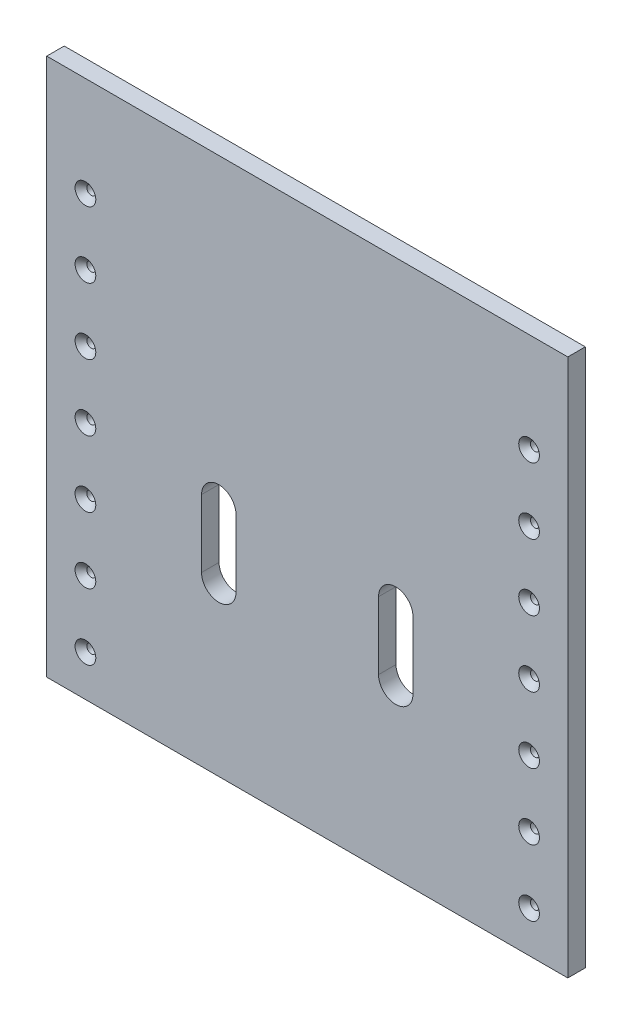
from build123d import *

# Parameters (mm, degrees)
SKETCH1_W                                       = 196.85
SKETCH1_H                                       = 203.2
BOSS_EXTRUDE1_DEPTH                             = 6.604
CUT_EXTRUDE7_DEPTH                              = 313.254468048
SKETCH4_W                                       = 196.85
SKETCH4_H                                       = 0.6096
BOSS_EXTRUDE2_DEPTH                             = 12
SKETCH14_W                                      = 196.85
SKETCH14_H                                      = 11.938
BOSS_EXTRUDE3_DEPTH                             = 6.604
SKETCH13_W                                      = 196.85
SKETCH13_H                                      = 0.6096
CUT_EXTRUDE9_DEPTH                              = 12
CSK_FOR_M3_FLAT_HEAD_MACHINE_SCREW3_D           = 3.4
CSK_FOR_M3_FLAT_HEAD_MACHINE_SCREW3_CSINK_D     = 7.824
CSK_FOR_M3_FLAT_HEAD_MACHINE_SCREW3_CSINK_ANGLE = 90


with BuildPart() as part:
    # Sketch1 → Boss-Extrude1 (new body)
    with BuildSketch(Plane(origin=(0, 0, 0), x_dir=(1, 0, 0), z_dir=(0, 0, -1))):
        with Locations((-104.775, 135.4)):
            Rectangle(SKETCH1_W, SKETCH1_H)
    extrude(amount=BOSS_EXTRUDE1_DEPTH)

    # Sketch2 → Cut-Extrude7 (cut, through all)
    with BuildSketch(Plane(origin=(0, 0, -6.604), x_dir=(1, 0, 0), z_dir=(0, 0, -1))):
        with BuildLine():
            Line((-131.7, 173.5), (-131.7, 148))
            ThreePointArc((-131.7, 148), (-138.2, 141.5), (-144.7, 148))
            Line((-144.7, 148), (-144.7, 173.5))
            ThreePointArc((-144.7, 173.5), (-138.2, 180), (-131.7, 173.5))
        make_face()
        with BuildLine():
            Line((-64.85, 173.5), (-64.85, 148))
            ThreePointArc((-64.85, 148), (-71.35, 141.5), (-77.85, 148))
            Line((-77.85, 148), (-77.85, 173.5))
            ThreePointArc((-77.85, 173.5), (-71.35, 180), (-64.85, 173.5))
        make_face()
    extrude(amount=-CUT_EXTRUDE7_DEPTH, mode=Mode.SUBTRACT)

    # Sketch4 → Boss-Extrude2 (add)
    with BuildSketch(Plane.XY):
        with Locations((-104.706641567, -34.1048)):
            Rectangle(SKETCH4_W, SKETCH4_H)
    extrude(amount=BOSS_EXTRUDE2_DEPTH)

    # Sketch14 → Boss-Extrude3 (add)
    with BuildSketch(Plane.XY):
        with Locations((-104.775, -53.935004147)):
            Rectangle(SKETCH14_W, SKETCH14_H)
    extrude(amount=-BOSS_EXTRUDE3_DEPTH)

    # Sketch13 → Cut-Extrude9 (cut)
    with BuildSketch(Plane.XY.offset(12)):
        with Locations((-104.706641567, -34.1048)):
            Rectangle(SKETCH13_W, SKETCH13_H)
    extrude(amount=-CUT_EXTRUDE9_DEPTH, mode=Mode.SUBTRACT)

    # CSK for M3 Flat Head Machine Screw3 (through all)
    with Locations(Plane.XY):
        with Locations((-188.576641567, -71.467767821), (-188.576641567, -221.467767821), (-188.576641567, -196.467767821), (-188.576641567, -171.467767821), (-188.576641567, -146.467767821), (-188.576641567, -121.467767821), (-188.576641567, -96.467767821)):
            csk_for_m3_flat_head_machine_screw3 = CounterSinkHole(CSK_FOR_M3_FLAT_HEAD_MACHINE_SCREW3_D / 2, CSK_FOR_M3_FLAT_HEAD_MACHINE_SCREW3_CSINK_D / 2, counter_sink_angle=CSK_FOR_M3_FLAT_HEAD_MACHINE_SCREW3_CSINK_ANGLE)

    # Mirror1: CSK for M3 Flat Head Machine Screw3 across plane
    add(csk_for_m3_flat_head_machine_screw3.mirror(Plane.ZY.offset(104.774999995)), mode=Mode.SUBTRACT)


solid = part.part
